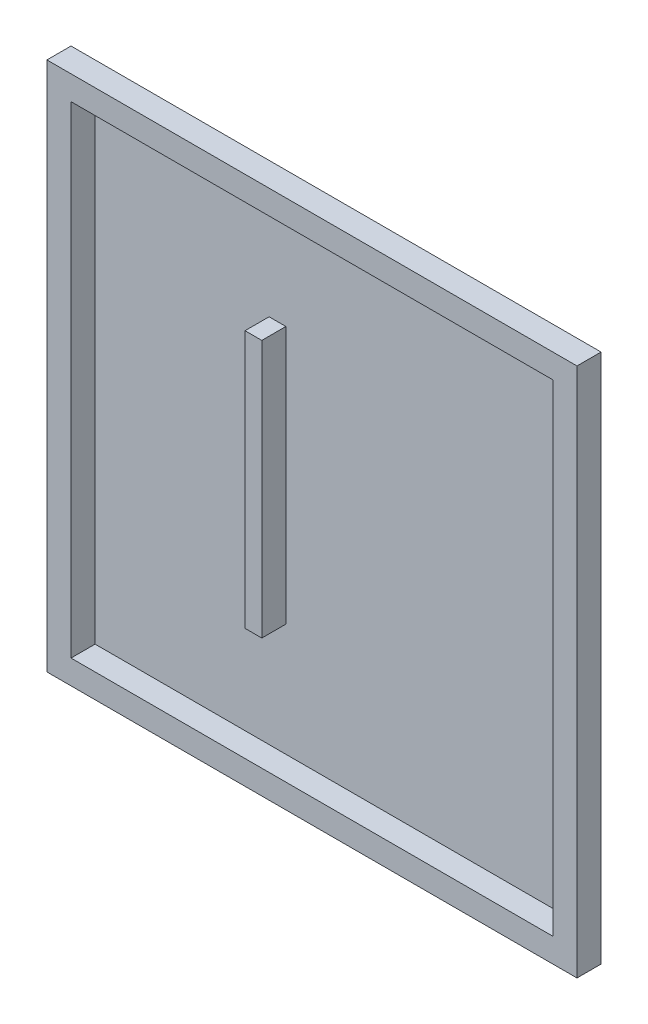
from build123d import *

# Parameters (mm, degrees)
SZKIC1_W                    = 20
SZKIC1_H                    = 20
DODANIE_WYCI_GNI_CIE1_DEPTH = 0.1
SZKIC2_W                    = 22
SZKIC2_H                    = 22
SZKIC2_W_2                  = 20
SZKIC2_H_2                  = 20
DODANIE_WYCI_GNI_CIE2_DEPTH = 1
SZKIC3_W                    = 0.696708677
SZKIC3_H                    = 10.699032121
DODANIE_WYCI_GNI_CIE3_DEPTH = 1


with BuildPart() as part:
    # Szkic1 → Dodanie-wyciągnięcie1 (new body)
    with BuildSketch(Plane.XY):
        with Locations((-11, 11)):
            Rectangle(SZKIC1_W, SZKIC1_H)
    extrude(amount=DODANIE_WYCI_GNI_CIE1_DEPTH)

    # Szkic3 → Dodanie-wyciągnięcie3 (add)
    with BuildSketch(Plane.XY.offset(0.1)):
        with Locations((-13.430215504, 11.028166078)):
            Rectangle(SZKIC3_W, SZKIC3_H)
    extrude(amount=DODANIE_WYCI_GNI_CIE3_DEPTH)


with BuildPart() as body_2:
    # Szkic2 → Dodanie-wyciągnięcie2 (new body)
    with BuildSketch(Plane.XY.offset(0.1)):
        with Locations((-11, 11)):
            Rectangle(SZKIC2_W, SZKIC2_H)
        with Locations((-11, 11)):
            Rectangle(SZKIC2_W_2, SZKIC2_H_2, mode=Mode.SUBTRACT)
    extrude(amount=DODANIE_WYCI_GNI_CIE2_DEPTH)


solid = Compound([part.part, body_2.part])
